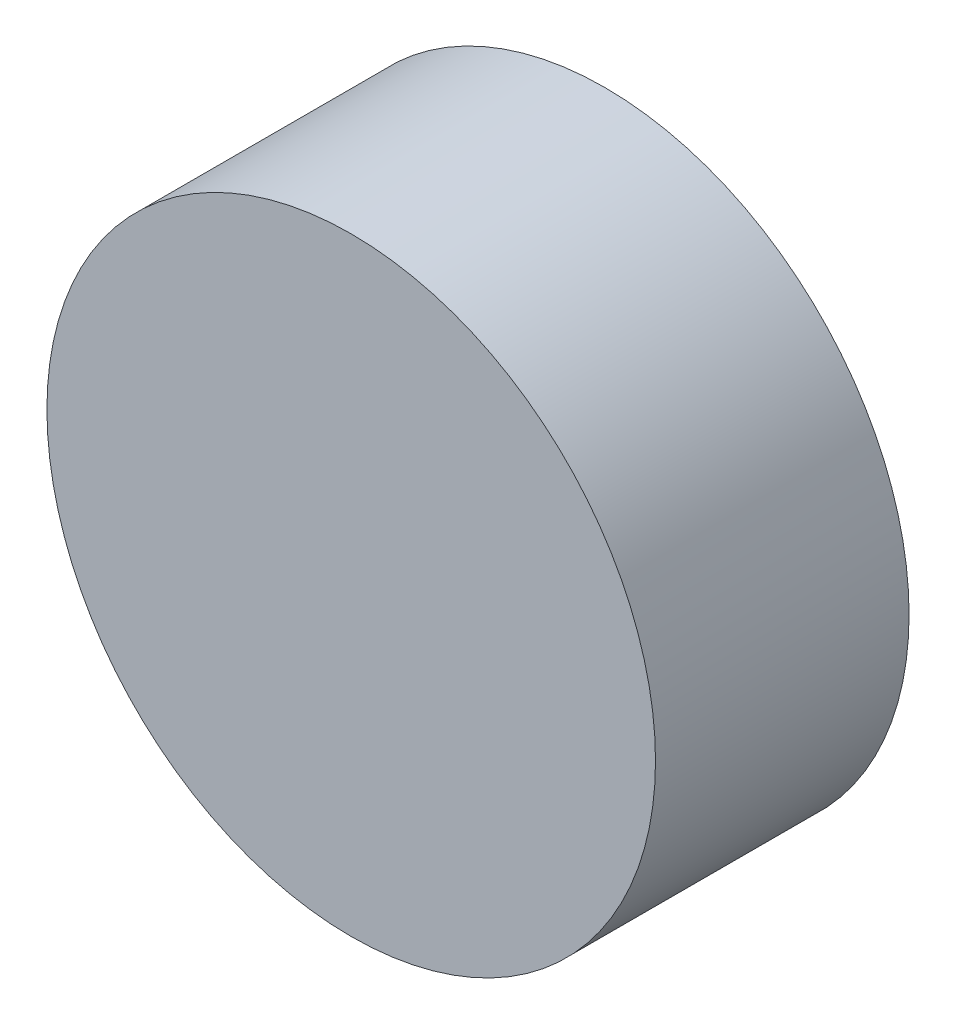
from build123d import *

# Parameters (mm, degrees)
SKETCH1_R    = 3
MAGNET_DEPTH = 2.5


with BuildPart() as part:
    # Sketch1 → Magnet (new body)
    with BuildSketch(Plane.XY):
        Circle(SKETCH1_R)
    extrude(amount=MAGNET_DEPTH)


solid = part.part
